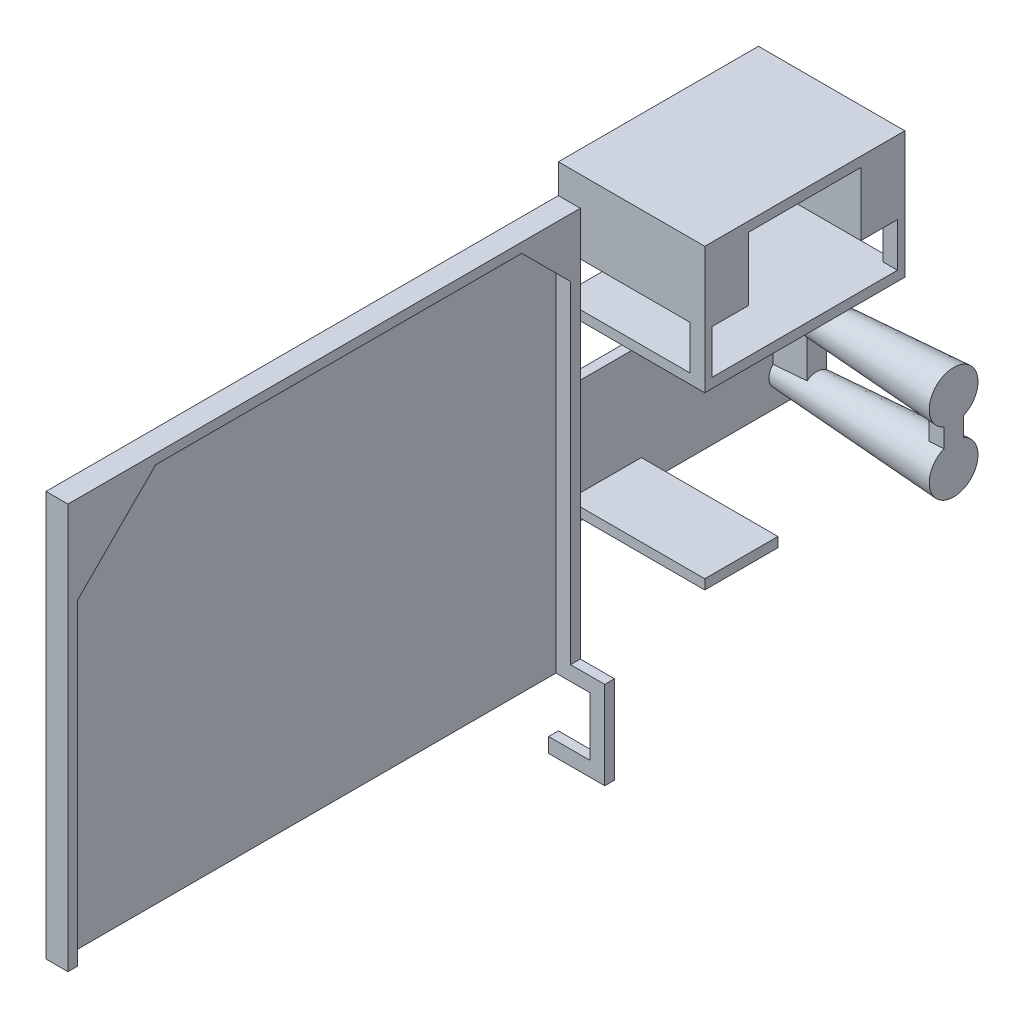
from build123d import *

# Parameters (mm, degrees)
SKETCH6_W            = 105
SKETCH6_H            = 83
BOSS_EXTRUDE3_DEPTH  = 4.5
SKETCH9_W            = 3
SKETCH9_H            = 101
CUT_EXTRUDE6_DEPTH   = 81
SKETCH10_W           = 1
SKETCH10_H           = 8
BOSS_EXTRUDE4_DEPTH  = 8
SKETCH11_W           = 1.226225524
SKETCH11_H           = 5
BOSS_EXTRUDE5_DEPTH  = 5
BOSS_EXTRUDE12_DEPTH = 1.226226
SKETCH27_W           = 15
SKETCH27_H           = 2
SKETCH27_W_2         = 41
SKETCH27_W_3         = 9
SKETCH27_H_2         = 15
BOSS_EXTRUDE20_DEPTH = 30
SKETCH28_W           = 1.5
SKETCH28_H           = 11
BOSS_EXTRUDE21_DEPTH = 3
SKETCH29_W           = 41
SKETCH29_H           = 2
BOSS_EXTRUDE22_DEPTH = 30
SKETCH30_W           = 2
SKETCH30_H           = 25
BOSS_EXTRUDE23_DEPTH = 50
SKETCH31_R           = 5
BOSS_EXTRUDE24_DEPTH = 35
DRAFT1_ANGLE         = -3.5
DRAFT3_ANGLE         = -3.5
SKETCH32_W           = 4
SKETCH32_H           = 15
BOSS_EXTRUDE25_DEPTH = 7
SKETCH33_W           = 4
SKETCH33_H           = 13
BOSS_EXTRUDE26_DEPTH = 3
SKETCH34_W           = 2
SKETCH34_H           = 3
BOSS_EXTRUDE27_DEPTH = 4
SKETCH35_W           = 2
SKETCH35_H           = 15
BOSS_EXTRUDE28_DEPTH = 3
SKETCH36_W           = 11.5
SKETCH36_H           = 2
BOSS_EXTRUDE29_DEPTH = 3


with BuildPart() as part:
    # Sketch6 → Boss-Extrude3 (new body)
    with BuildSketch(Plane(origin=(0, 0, 0), x_dir=(0, 0, -1), z_dir=(1, 0, 0))):
        with Locations((52.5, -41.5)):
            Rectangle(SKETCH6_W, SKETCH6_H)
    extrude(amount=BOSS_EXTRUDE3_DEPTH)

    # Sketch9 → Cut-Extrude6 (cut)
    with BuildSketch(Plane.XZ.offset(83)):
        with Locations((3, -52.5)):
            Rectangle(SKETCH9_W, SKETCH9_H)
    extrude(amount=-CUT_EXTRUDE6_DEPTH, mode=Mode.SUBTRACT)

    # Sketch10 → Boss-Extrude4 (add)
    with BuildSketch(Plane(origin=(0, 0, -2), x_dir=(-1, 0, 0), z_dir=(0, 0, -1))):
        with Locations((-4, -6)):
            Rectangle(SKETCH10_W, SKETCH10_H)
    extrude(amount=BOSS_EXTRUDE4_DEPTH)

    # Sketch11 → Boss-Extrude5 (add)
    with BuildSketch(Plane.XY.offset(-103)):
        with Locations((3.886887238, -4.5)):
            Rectangle(SKETCH11_W, SKETCH11_H)
    extrude(amount=BOSS_EXTRUDE5_DEPTH)

    # Sketch18 → Boss-Extrude12 (add)
    with BuildSketch(Plane(origin=(4.5, 0, 0), x_dir=(0, 0, -1), z_dir=(1, 0, 0))):
        Polygon((103, -12), (93, -2), (103, -2), align=None)
        Polygon((18, -2), (2, -2), (2, -18), align=None)
    extrude(amount=-BOSS_EXTRUDE12_DEPTH)

    # Sketch27 → Boss-Extrude20 (add)
    with BuildSketch(Plane.ZY):
        with Locations((-112.5, -54)):
            Rectangle(SKETCH27_W, SKETCH27_H)
        with Locations((-125.5, -19)):
            Rectangle(SKETCH27_W_2, SKETCH27_H)
        with Locations((-109.5, -1.5)):
            Rectangle(SKETCH27_W_3, SKETCH27_H_2)
        with Locations((-141.5, -1.5)):
            Rectangle(SKETCH27_W_3, SKETCH27_H_2)
    extrude(amount=-BOSS_EXTRUDE20_DEPTH)


with BuildPart() as boss_extrude20_piece_1:
    # of the separate pieces the step leaves, piece 1, a body of its own (boss_extrude20_pieces)
    add(part.part.solids().sort_by_distance((0, 0, 0))[0])



with BuildPart() as boss_extrude20_piece_2:
    # of the separate pieces the step leaves, piece 2, a body of its own (boss_extrude20_pieces)
    add(part.part.solids().sort_by_distance((0, 6, -146))[0])


with BuildPart() as boss_extrude20_piece_1_1:
    add(boss_extrude20_piece_1.part)

    add(boss_extrude20_piece_2.part)  # Boss-Extrude21 merges Boss-Extrude20 piece 2
    # Sketch28 → Boss-Extrude21 (add)
    with BuildSketch(Plane(origin=(30, 0, 0), x_dir=(0, 0, -1), z_dir=(1, 0, 0))):
        with Locations((145.25, -14.5)):
            Rectangle(SKETCH28_W, SKETCH28_H)
        with Locations((105.75, -14.5)):
            Rectangle(SKETCH28_W, SKETCH28_H)
    extrude(amount=-BOSS_EXTRUDE21_DEPTH)

    # Sketch29 → Boss-Extrude22 (add)
    with BuildSketch(Plane(origin=(30, 0, 0), x_dir=(0, 0, -1), z_dir=(1, 0, 0))):
        with Locations((125.5, 5)):
            Rectangle(SKETCH29_W, SKETCH29_H)
    extrude(amount=-BOSS_EXTRUDE22_DEPTH)

    # Sketch30 → Boss-Extrude23 (add)
    with BuildSketch(Plane(origin=(0, 0, -105), x_dir=(-1, 0, 0), z_dir=(0, 0, -1))):
        with Locations((-1, -45.5)):
            Rectangle(SKETCH30_W, SKETCH30_H)
    extrude(amount=BOSS_EXTRUDE23_DEPTH)

    # Sketch31 → Boss-Extrude24 (add)
    with BuildSketch(Plane(origin=(2, 0, 0), x_dir=(0, 0, -1), z_dir=(1, 0, 0))):
        with Locations(Location((149, -52, 0), (0, 0, 180))):
            Circle(SKETCH31_R)
        with Locations(Location((149, -39, 0), (0, 0, 180))):
            Circle(SKETCH31_R)
    extrude(amount=BOSS_EXTRUDE24_DEPTH)

    # Draft1
    draft1_faces = [boss_extrude20_piece_1_1.faces().sort_by_distance(p)[0] for p in [
        (19.5, -52, -154),
    ]]
    draft(draft1_faces, Plane(origin=(37, -52, -149), x_dir=(0, 0, 1), z_dir=(1, 0, 0)), DRAFT1_ANGLE)

    # Draft3
    draft3_faces = [boss_extrude20_piece_1_1.faces().sort_by_distance(p)[0] for p in [
        (19.5, -39, -154),
    ]]
    draft(draft3_faces, Plane(origin=(37, -39, -149), x_dir=(0, 0, 1), z_dir=(1, 0, 0)), DRAFT3_ANGLE)

    # Sketch32 → Boss-Extrude25 (add)
    with BuildSketch(Plane(origin=(2, 0, 0), x_dir=(0, 0, -1), z_dir=(1, 0, 0))):
        with Locations((149, -45.5)):
            Rectangle(SKETCH32_W, SKETCH32_H)
    extrude(amount=BOSS_EXTRUDE25_DEPTH)

    # Sketch33 → Boss-Extrude26 (add)
    with BuildSketch(Plane(origin=(37, 0, 0), x_dir=(0, 0, -1), z_dir=(1, 0, 0))):
        with Locations((149, -45.5)):
            Rectangle(SKETCH33_W, SKETCH33_H)
    extrude(amount=-BOSS_EXTRUDE26_DEPTH)

    # Sketch34 → Boss-Extrude27 (add)
    with BuildSketch(Plane(origin=(4.5, 0, 0), x_dir=(0, 0, -1), z_dir=(1, 0, 0))):
        with Locations((104, -81.5)):
            Rectangle(SKETCH34_W, SKETCH34_H)
    extrude(amount=BOSS_EXTRUDE27_DEPTH)

    # Sketch35 → Boss-Extrude28 (add)
    with BuildSketch(Plane(origin=(8.5, 0, 0), x_dir=(0, 0, -1), z_dir=(1, 0, 0))):
        with Locations((104, -87.5)):
            Rectangle(SKETCH35_W, SKETCH35_H)
    extrude(amount=BOSS_EXTRUDE28_DEPTH)

    # Sketch36 → Boss-Extrude29 (add)
    with BuildSketch(Plane(origin=(0, -95, 0), x_dir=(-1, 0, 0), z_dir=(0, -1, 0))):
        with Locations((-5.75, 104)):
            Rectangle(SKETCH36_W, SKETCH36_H)
    extrude(amount=BOSS_EXTRUDE29_DEPTH)


solid = boss_extrude20_piece_1_1.part
